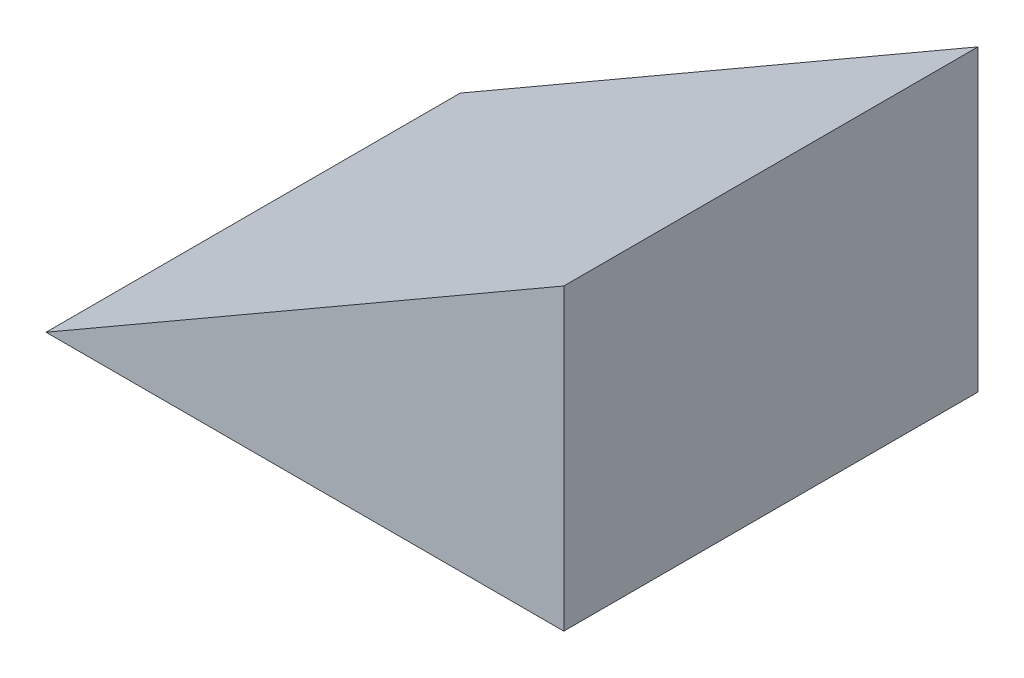
from build123d import *

# Parameters (mm, degrees)
EXTRUDE_1_DEPTH = 8


with BuildPart() as part:
    # 草圖1 → 填料-伸長1 (new body)
    with BuildSketch(Plane.XY):
        Polygon((-15.244141393, -20.148564704), (-5.244141393, -20.148564704), (-5.244141393, -14.375062012), align=None)
    extrude(amount=EXTRUDE_1_DEPTH)


solid = part.part
